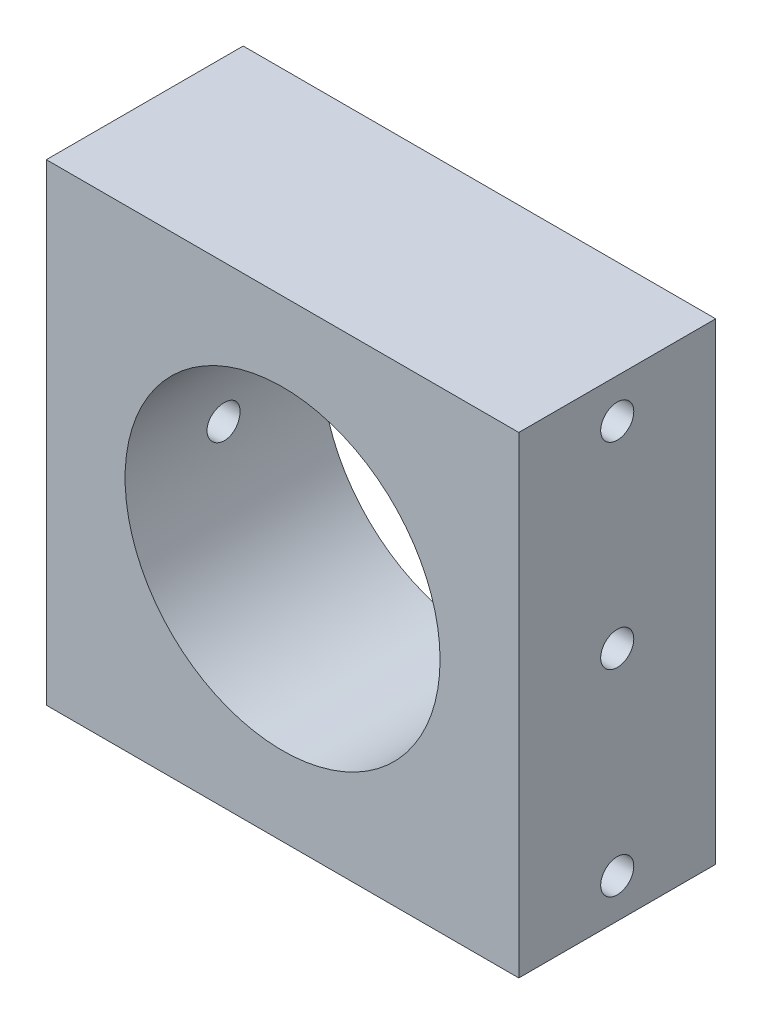
from build123d import *

# Parameters (mm, degrees)
BOSS_EXTRUDE1_DEPTH = 25
SKETCH2_R           = 2.1
CUT_EXTRUDE1_DEPTH  = 72.589105316


with BuildPart() as part:
    # Sketch1 → Boss-Extrude1 (new body)
    with BuildSketch(Plane.XY):
        with BuildLine():
            Line((-30, 0), (-20, 0))
            ThreePointArc((-20, 0), (0, 20), (20, 0))
            Line((20, 0), (30, 0))
            Line((30, 0), (30, 30))
            Line((30, 30), (-30, 30))
            Line((-30, 30), (-30, 0))
        make_face()
        with BuildLine():
            ThreePointArc((20, 0), (0, -20), (-20, 0))
            Line((-20, 0), (-30, 0))
            Line((-30, 0), (-30, -30))
            Line((-30, -30), (30, -30))
            Line((30, -30), (30, 0))
            Line((30, 0), (20, 0))
        make_face()
    extrude(amount=BOSS_EXTRUDE1_DEPTH)

    # Sketch2 → Cut-Extrude1 (cut, through all)
    with BuildSketch(Plane(origin=(30, 0, 0), x_dir=(0, 0, -1), z_dir=(1, 0, 0))):
        with Locations((-12.5, 25)):
            Circle(SKETCH2_R)
        with Locations((-12.5, -25)):
            Circle(SKETCH2_R)
        with Locations((-12.5, 0)):
            Circle(SKETCH2_R)
    extrude(amount=-CUT_EXTRUDE1_DEPTH, mode=Mode.SUBTRACT)


solid = part.part
